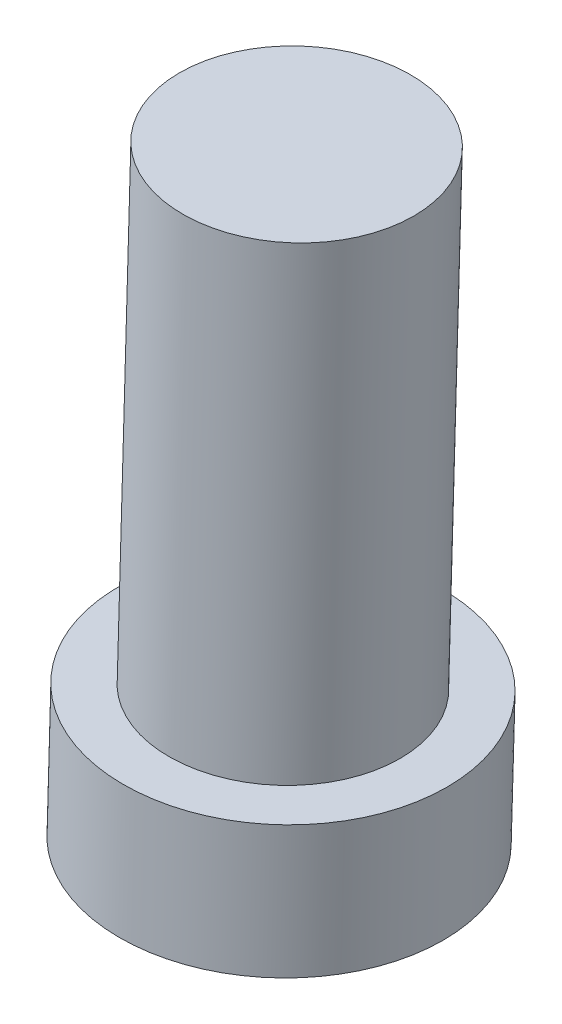
from build123d import *


with BuildPart() as part:
    # Esquisse1 → Révolution1 (revolve)
    with BuildSketch(Plane.XY.offset(-216.567475333)):
        Polygon((-182.617937948, 44.424645621), (-192.613797601, 44.71237777), (-194.113827305, -7.398887585), (-180.11962379, -7.801712594), (-179.789374694, 3.671192396), (-183.787718556, 3.786285256), align=None)
    revolve(axis=Axis((-192.603180288, 45.081224869, -216.567475333), (-0.028773214958103643, -0.9995859653381368, 0)))


solid = part.part
